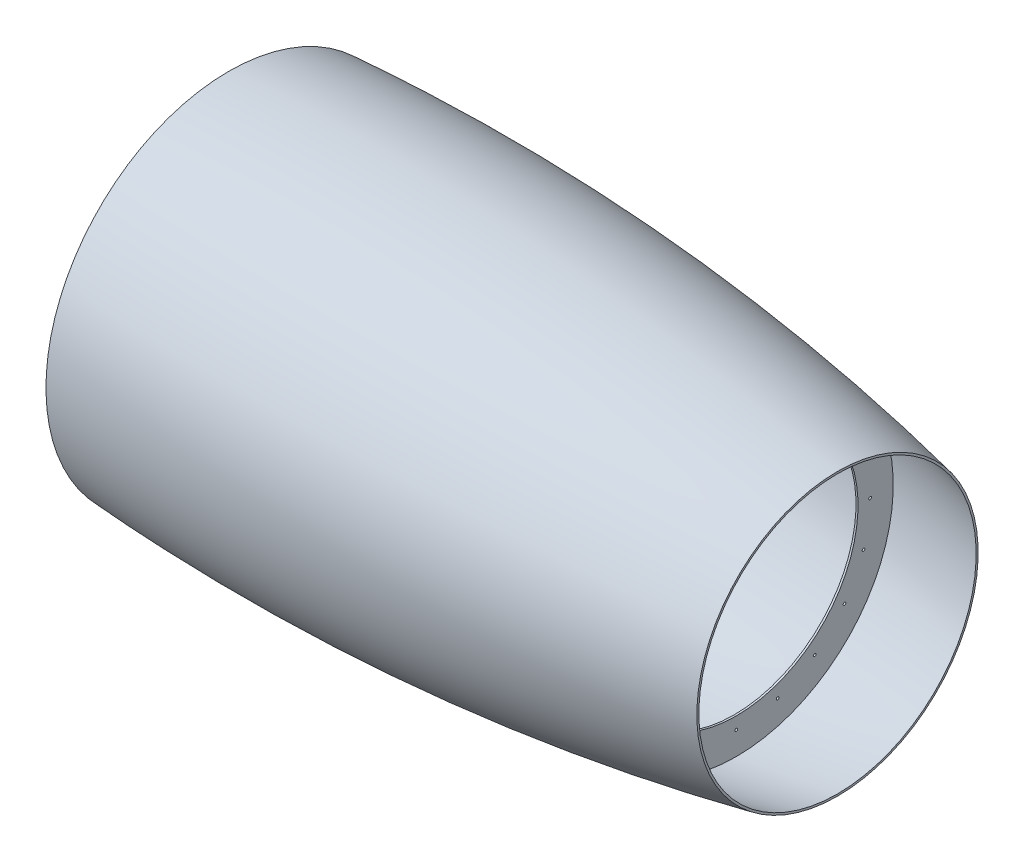
from build123d import *

# Parameters (mm, degrees)
SKETCH3_R          = 4
CUT_EXTRUDE1_DEPTH = 10
SKETCH4_R          = 2
CUT_EXTRUDE2_DEPTH = 10
CIRPATTERN1_COUNT  = 20


with BuildPart() as part:
    # Sketch1 → Revolve1 (revolve)
    with BuildSketch(Plane.XY):
        with BuildLine():
            Line((-452, 244), (-452, 271.624344795))
            ThreePointArc((-452, 271.624344795), (-377.95560373, 275.255781146), (-303.850836324, 277.315731773))
            Line((-303.850836324, 277.315731773), (-303.850836324, 225))
            Line((-303.850836324, 225), (-300.850836324, 225))
            Line((-300.850836324, 225), (-300.850836324, 277.365999394))
            ThreePointArc((-300.850836324, 277.365999394), (0.818771678, 269.259306116), (300.664150406, 235.156231124))
            Line((300.664150406, 235.156231124), (300.664150406, 182))
            Line((300.664150406, 182), (303.664150406, 182))
            Line((303.664150406, 182), (303.664150406, 234.68170782))
            ThreePointArc((303.664150406, 234.68170782), (379.483006809, 221.798516716), (455, 207.25))
            Line((455, 207.25), (455, 210.25))
            ThreePointArc((455, 210.25), (2.106694049, 272.178347011), (-455, 273.146331596))
            Line((-455, 273.146331596), (-455, 244))
            Line((-455, 244), (-452, 244))
        make_face()
    revolve(axis=Axis((433.387930782, 0, 0), (-1, 0, 0)))

    # Sketch3 → Cut-Extrude1 (cut)
    with BuildSketch(Plane.ZY.offset(455)):
        with Locations(Location((40, 256.904651573, 0), (0, 0, 270))):
            Circle(SKETCH3_R)
    cut_extrude1 = extrude(amount=-CUT_EXTRUDE1_DEPTH, mode=Mode.SUBTRACT)

    # Sketch4 → Cut-Extrude2 (cut)
    with BuildSketch(Plane(origin=(303.664150406, 0, 0), x_dir=(0, 0, -1), z_dir=(1, 0, 0))):
        with Locations(Location((0, 200, 0), (0, 0, 90))):
            Circle(SKETCH4_R)
    cut_extrude2 = extrude(amount=-CUT_EXTRUDE2_DEPTH, mode=Mode.SUBTRACT)

    # CirPattern1: Cut-Extrude1, Cut-Extrude2 ×20 about axis
    cirpattern1_axis = Axis((0, 0, 0), (1, 0, 0))
    add([cut_extrude1.rotate(cirpattern1_axis, i * 360 / CIRPATTERN1_COUNT) for i in range(1, CIRPATTERN1_COUNT)], mode=Mode.SUBTRACT)
    add([cut_extrude2.rotate(cirpattern1_axis, i * 360 / CIRPATTERN1_COUNT) for i in range(1, CIRPATTERN1_COUNT)], mode=Mode.SUBTRACT)


solid = part.part
